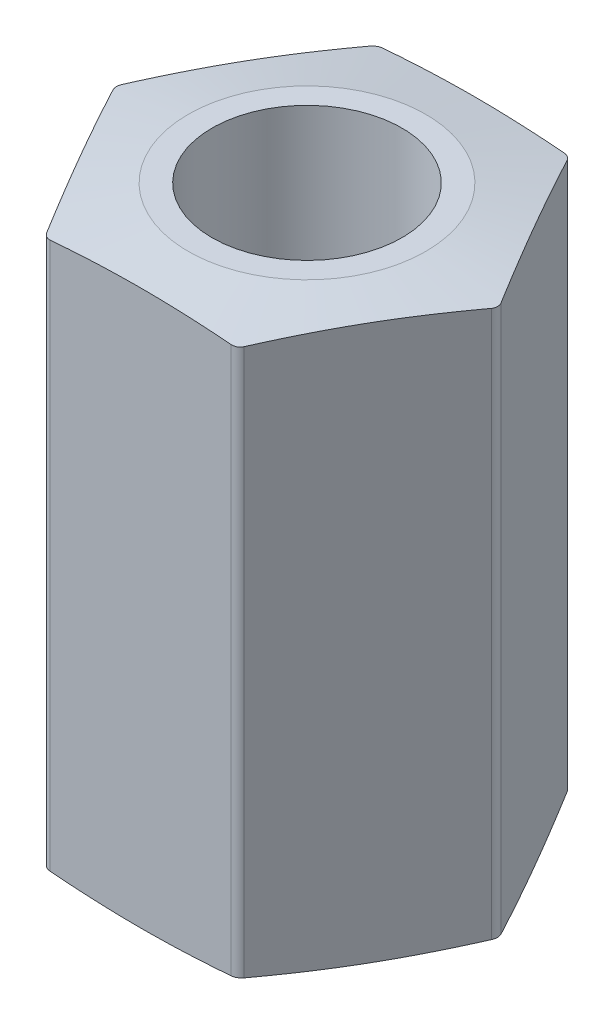
from build123d import *

# Parameters (mm, degrees)
EXTRUDE_1_DEPTH     = 6
FILLET_1_R          = 0.2
SKETCH_3_R          = 2
CUT_EXTRUDE_1_DEPTH = 8


with BuildPart() as part:
    # 草图1 → 凸台-拉伸1 (new, symmetric)
    with BuildSketch(Plane(origin=(0, 0, 0), x_dir=(1, 0, 0), z_dir=(0, 1, 0))):
        Polygon((4.041451884, 0), (2.020725942, 3.5), (-2.020725942, 3.5), (-4.041451884, 0), (-2.020725942, -3.5), (2.020725942, -3.5), align=None)
    extrude(amount=EXTRUDE_1_DEPTH, both=True)

    # 圆角1
    fillet_1_edges = [part.edges().sort_by_distance(p)[0] for p in [
        (2.020725942, 0, 3.5),
        (-2.020725942, 0, 3.5),
        (-4.041451884, 0, 0),
        (-2.020725942, 0, -3.5),
        (2.020725942, 0, -3.5),
        (4.041451884, 0, 0),
    ]]
    fillet(fillet_1_edges, radius=FILLET_1_R)

    # 草图3 → 切除-拉伸1 (cut)
    with BuildSketch(Plane(origin=(0, 6, 0), x_dir=(1, 0, 0), z_dir=(0, 1, 0))):
        with Locations(Location((0, 0, 0), (0, 0, 270))):
            Circle(SKETCH_3_R)
    cut_extrude_1 = extrude(amount=-CUT_EXTRUDE_1_DEPTH, mode=Mode.SUBTRACT)

    # 草图4 → 切除-旋转1 (revolve, cut)
    with BuildSketch(Plane.XY, mode=Mode.PRIVATE) as cut_revolve_1_sk:
        Polygon((-4.010511777, 6), (-4.010511777, 5.75), (-2.5, 6), align=None)
    cut_revolve_1 = revolve(cut_revolve_1_sk.sketch.rotate(Axis((0, 0, 0), (0, 1, 0)), 180), axis=Axis((0, 0, 0), (0, 1, 0)), mode=Mode.SUBTRACT)

    # 镜向1: 切除-拉伸1, 切除-旋转1 across plane
    add(cut_extrude_1.mirror(Plane.ZX), mode=Mode.SUBTRACT)
    add(cut_revolve_1.mirror(Plane.ZX), mode=Mode.SUBTRACT)


solid = part.part
